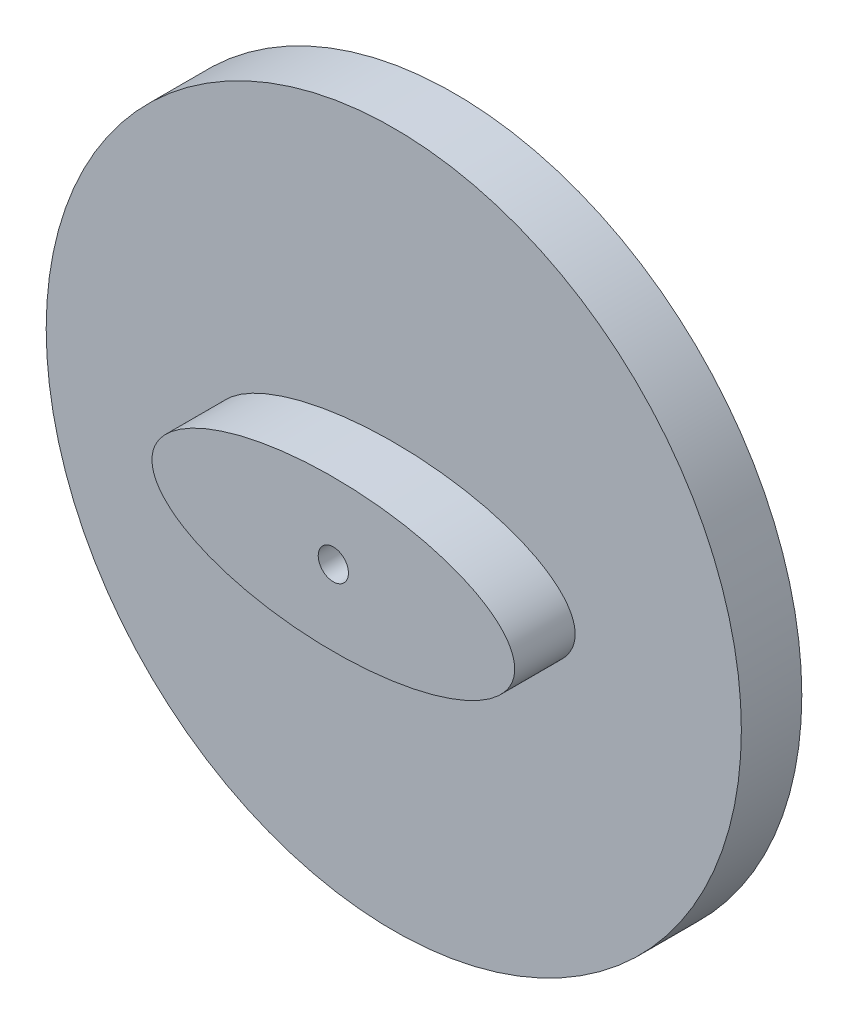
from build123d import *

# Parameters (mm, degrees)
ESQUISSE1_R             = 11.5
BOSS_EXTRU_1_DEPTH      = 2
ESQUISSE6_RX            = 6
ESQUISSE6_RY            = 2.5
BOSS_EXTRU_5_DEPTH      = 2
ESQUISSE7_R             = 0.5
ENL_V_MAT_EXTRU_1_DEPTH = 17.748134224


with BuildPart() as part:
    # Esquisse1 → Boss.-Extru.1 (new body)
    with BuildSketch(Plane.XY):
        Circle(ESQUISSE1_R)
    extrude(amount=BOSS_EXTRU_1_DEPTH)

    # Esquisse6 → Boss.-Extru.5 (add)
    with BuildSketch(Plane.XY.offset(2)):
        with Locations((0, 0)):
            Ellipse(ESQUISSE6_RX, ESQUISSE6_RY)
    extrude(amount=BOSS_EXTRU_5_DEPTH)

    # Esquisse7 → Enlèv. mat.-Extru.1 (cut, through all)
    with BuildSketch(Plane(origin=(0, 0, 0), x_dir=(-1, 0, 0), z_dir=(0, 0, -1))):
        Circle(ESQUISSE7_R)
    extrude(amount=-ENL_V_MAT_EXTRU_1_DEPTH, mode=Mode.SUBTRACT)


solid = part.part
